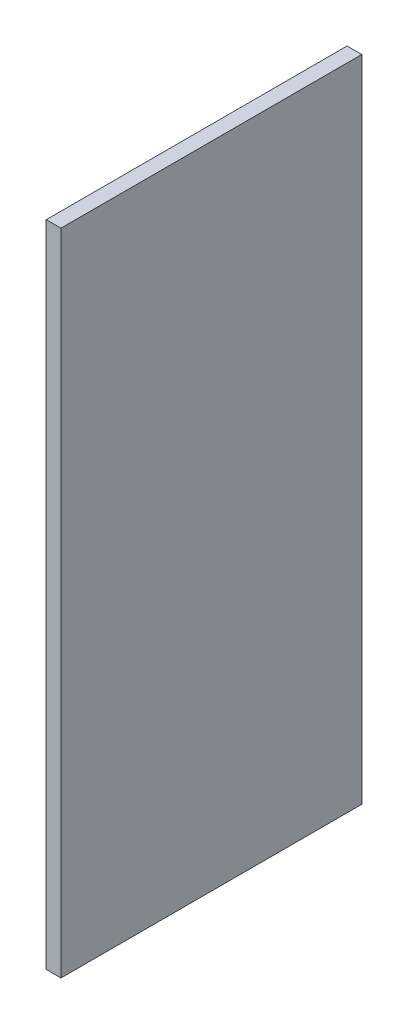
from build123d import *

# Parameters (mm, degrees)
SKETCH1_W                  = 40
SKETCH1_H                  = 1767
TOPPING_PU_YAN_SOL_1_DEPTH = 818.5


with BuildPart() as part:
    # Sketch1 → TOPPING_pu_yan_sol_1 (new body)
    with BuildSketch(Plane.XY):
        with Locations((21.5, 1085)):
            Rectangle(SKETCH1_W, SKETCH1_H)
    extrude(amount=-TOPPING_PU_YAN_SOL_1_DEPTH)


solid = part.part
